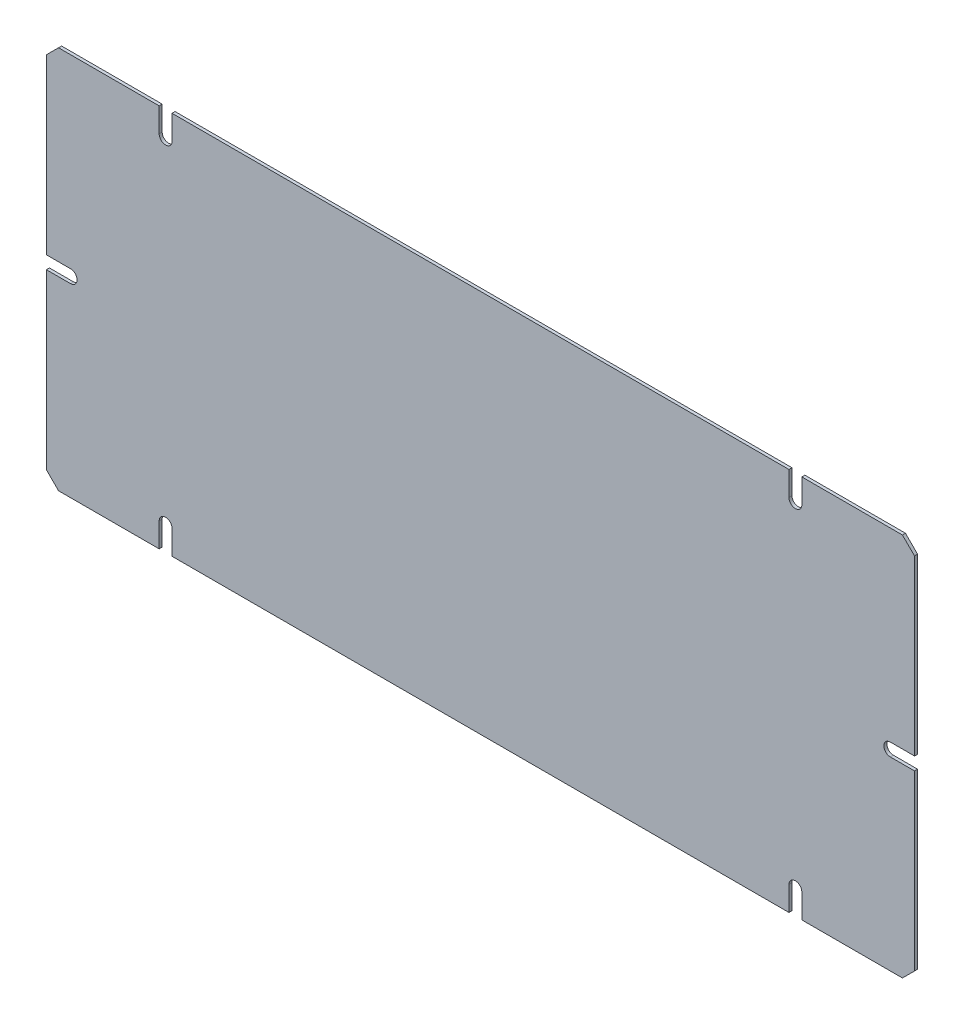
from build123d import *

# Parameters (mm, degrees)
SKETCH1_W               = 455.168
SKETCH1_H               = 201.168
BOSS_EXTRUDE1_DEPTH     = 1.5875
F_1_4_CLEARANCE_HOLE1_D = 6.7564
CHAMFER1_SIZE           = 6.35
CUT_EXTRUDE1_REACH      = 250.826
SKETCH4_W               = 6.7564
SKETCH4_H               = 14.488627811
CUT_EXTRUDE2_REACH      = 250.826
SKETCH5_W               = 19.05
SKETCH5_H               = 6.7564


with BuildPart() as part:
    # Sketch1 → Boss-Extrude1 (new body)
    with BuildSketch(Plane.XY):
        Rectangle(SKETCH1_W, SKETCH1_H)
    extrude(amount=BOSS_EXTRUDE1_DEPTH)

    # 1/4 Clearance Hole1 (through all)
    with Locations(Plane.XY.offset(1.5875)):
        with Locations((-165.1, 87.884), (165.1, 87.884), (214.884, 0), (-214.884, 0), (-165.1, -87.884), (165.1, -87.884)):
            Hole(F_1_4_CLEARANCE_HOLE1_D / 2)

    # Chamfer1
    chamfer1_edges = [part.edges().sort_by_distance(p)[0] for p in [
        (227.584, -100.584, 0.79375),
        (-227.584, -100.584, 0.79375),
        (-227.584, 100.584, 0.79375),
        (227.584, 100.584, 0.79375),
    ]]
    chamfer(chamfer1_edges, length=CHAMFER1_SIZE)

    # Sketch4 → Cut-Extrude1 (cut, up to next)
    with BuildSketch(Plane.XY.offset(1.5875), mode=Mode.PRIVATE) as cut_extrude1_sk1:
        with Locations((-165.1, 95.128313905)):
            Rectangle(SKETCH4_W, SKETCH4_H)
    cut_extrude1_tool1 = extrude(cut_extrude1_sk1.sketch, amount=-CUT_EXTRUDE1_REACH, mode=Mode.PRIVATE) & part.part
    # Sketch4 → Cut-Extrude1 (cut, up to next)
    with BuildSketch(Plane.XY.offset(1.5875), mode=Mode.PRIVATE) as cut_extrude1_sk2:
        with Locations((165.1, 95.128313905)):
            Rectangle(SKETCH4_W, SKETCH4_H)
    cut_extrude1_tool2 = extrude(cut_extrude1_sk2.sketch, amount=-CUT_EXTRUDE1_REACH, mode=Mode.PRIVATE) & part.part
    cut_extrude1_1 = cut_extrude1_tool1.solids().sort_by_distance((-165.1, 95.128314, 1.5875))[0]
    add(cut_extrude1_1, mode=Mode.SUBTRACT)
    cut_extrude1_2 = cut_extrude1_tool2.solids().sort_by_distance((165.1, 95.128314, 1.5875))[0]
    add(cut_extrude1_2, mode=Mode.SUBTRACT)
    cut_extrude1 = cut_extrude1_1 + cut_extrude1_2  # Cut-Extrude1 as one shape, for the pattern or mirror that repeats it

    # Mirror5: Cut-Extrude1 across plane
    add(cut_extrude1.mirror(Plane.ZX), mode=Mode.SUBTRACT)

    # Sketch5 → Cut-Extrude2 (cut, up to next)
    with BuildSketch(Plane.XY.offset(1.5875), mode=Mode.PRIVATE) as cut_extrude2_sk1:
        with Locations((-224.409, 0)):
            Rectangle(SKETCH5_W, SKETCH5_H)
    cut_extrude2_tool1 = extrude(cut_extrude2_sk1.sketch, amount=-CUT_EXTRUDE2_REACH, mode=Mode.PRIVATE) & part.part
    cut_extrude2 = cut_extrude2_tool1.solids().sort_by_distance((-224.409, 0, 1.5875))[0]
    add(cut_extrude2, mode=Mode.SUBTRACT)

    # Mirror6: Cut-Extrude2 across plane
    add(cut_extrude2.mirror(Plane(origin=(0, 0, 0), x_dir=(0, 0, 1), z_dir=(1, 0, 0))), mode=Mode.SUBTRACT)


solid = part.part
